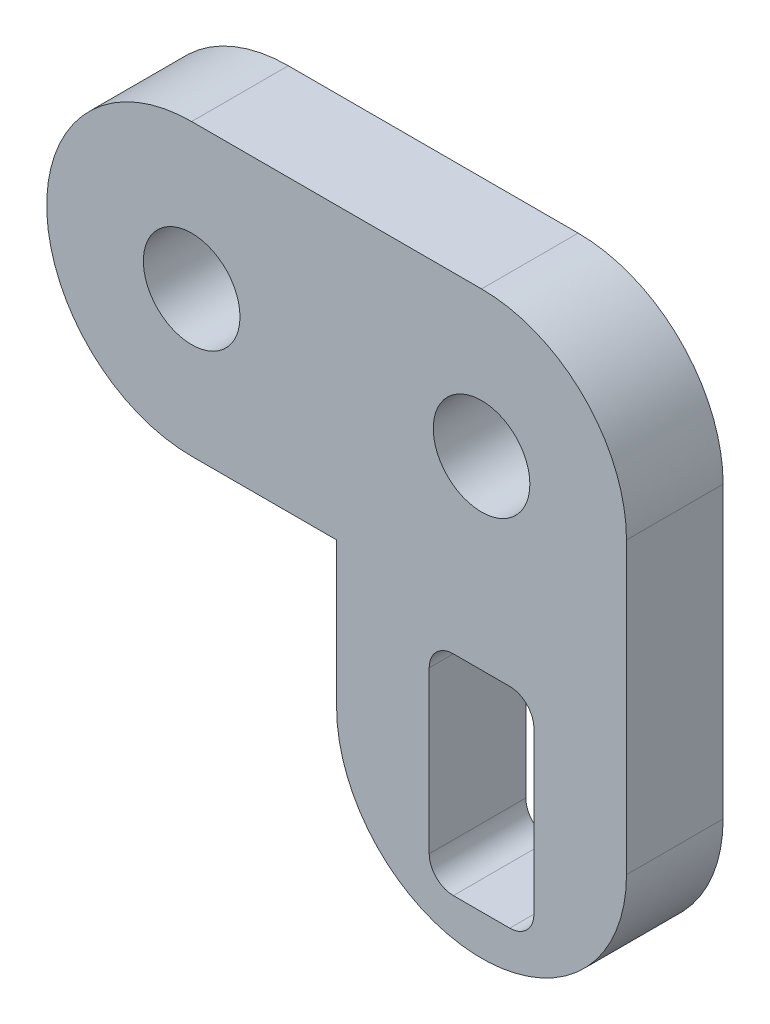
from build123d import *

# Parameters (mm, degrees)
MODEL_R                 = 1.5
SALIENTE_EXTRUIR1_DEPTH = 3


with BuildPart() as part:
    # Model → Saliente-Extruir1 (new body)
    with BuildSketch(Plane.XY):
        with BuildLine():
            Line((149.34213351, 211.823953209), (158.34213351, 211.823953209))
            ThreePointArc((158.34213351, 211.823953209), (161.524114025, 210.505933724), (162.84213351, 207.323953209))
            Line((162.84213351, 207.323953209), (162.84213351, 198.323953209))
            ThreePointArc((162.84213351, 198.323953209), (158.34213351, 193.823953209), (153.84213351, 198.323953209))
            Line((153.84213351, 198.323953209), (153.84213351, 202.823953209))
            Line((153.84213351, 202.823953209), (149.34213351, 202.823953209))
            ThreePointArc((149.34213351, 202.823953209), (144.84213351, 207.323953209), (149.34213351, 211.823953209))
        make_face()
        with Locations((149.34213351, 207.323953209)):
            Circle(MODEL_R, mode=Mode.SUBTRACT)
        with Locations((158.34213351, 207.323953209)):
            Circle(MODEL_R, mode=Mode.SUBTRACT)
        with BuildLine():
            Line((156.71713351, 195.823953209), (156.71713351, 200.823953209))
            ThreePointArc((156.71713351, 200.823953209), (156.936803424, 201.354283295), (157.46713351, 201.573953209))
            Line((157.46713351, 201.573953209), (159.21713351, 201.573953209))
            ThreePointArc((159.21713351, 201.573953209), (159.747463595, 201.354283295), (159.96713351, 200.823953209))
            Line((159.96713351, 200.823953209), (159.96713351, 195.823953209))
            ThreePointArc((159.96713351, 195.823953209), (159.747463595, 195.293623123), (159.21713351, 195.073953209))
            Line((159.21713351, 195.073953209), (157.46713351, 195.073953209))
            ThreePointArc((157.46713351, 195.073953209), (156.936803424, 195.293623123), (156.71713351, 195.823953209))
        make_face(mode=Mode.SUBTRACT)
    extrude(amount=SALIENTE_EXTRUIR1_DEPTH)


solid = part.part
